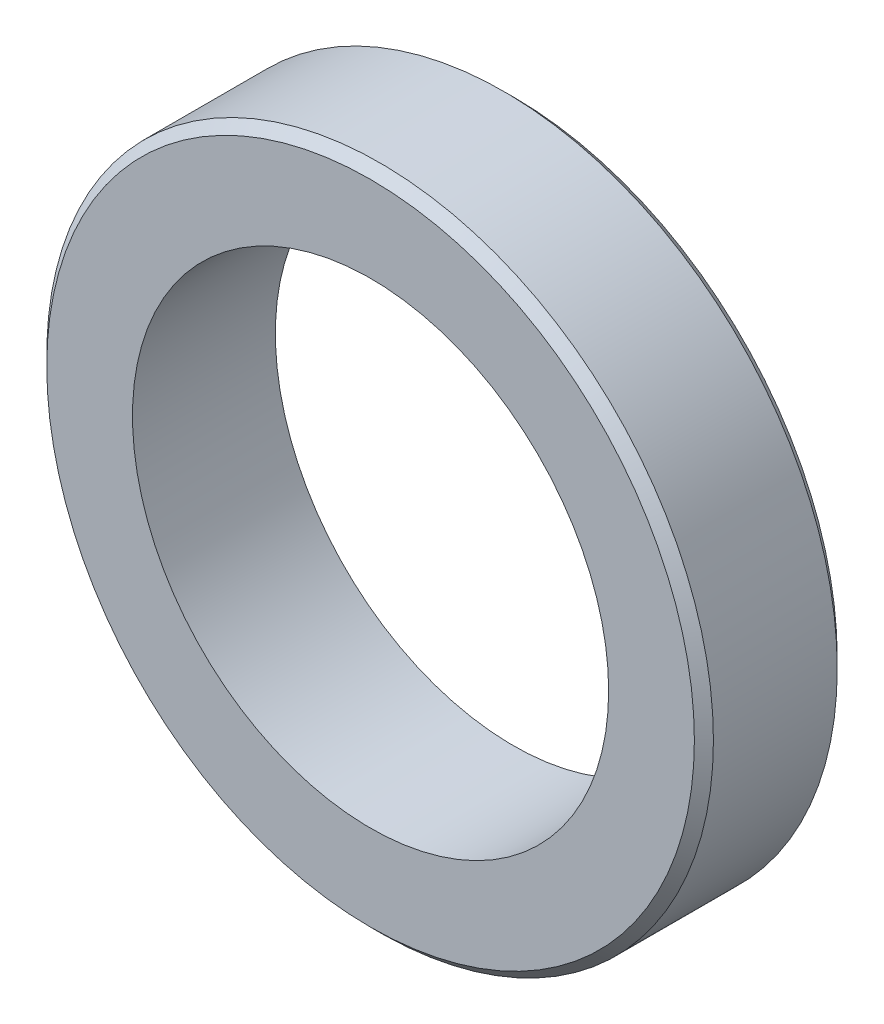
from build123d import *

# Parameters (mm, degrees)
SKETCH_1_R      = 35
SKETCH_1_R_2    = 25
EXTRUDE_1_DEPTH = 15
CHAMFER_1_SIZE  = 1


with BuildPart() as part:
    # 草图1 → 凸台-拉伸1 (new body)
    with BuildSketch(Plane.XY):
        Circle(SKETCH_1_R)
        Circle(SKETCH_1_R_2, mode=Mode.SUBTRACT)
    extrude(amount=EXTRUDE_1_DEPTH)

    # 倒角1
    chamfer_1_edges = [part.edges().sort_by_distance(p)[0] for p in [
        (-35, 0, 0),
        (-35, 0, 15),
    ]]
    chamfer(chamfer_1_edges, length=CHAMFER_1_SIZE)


solid = part.part
